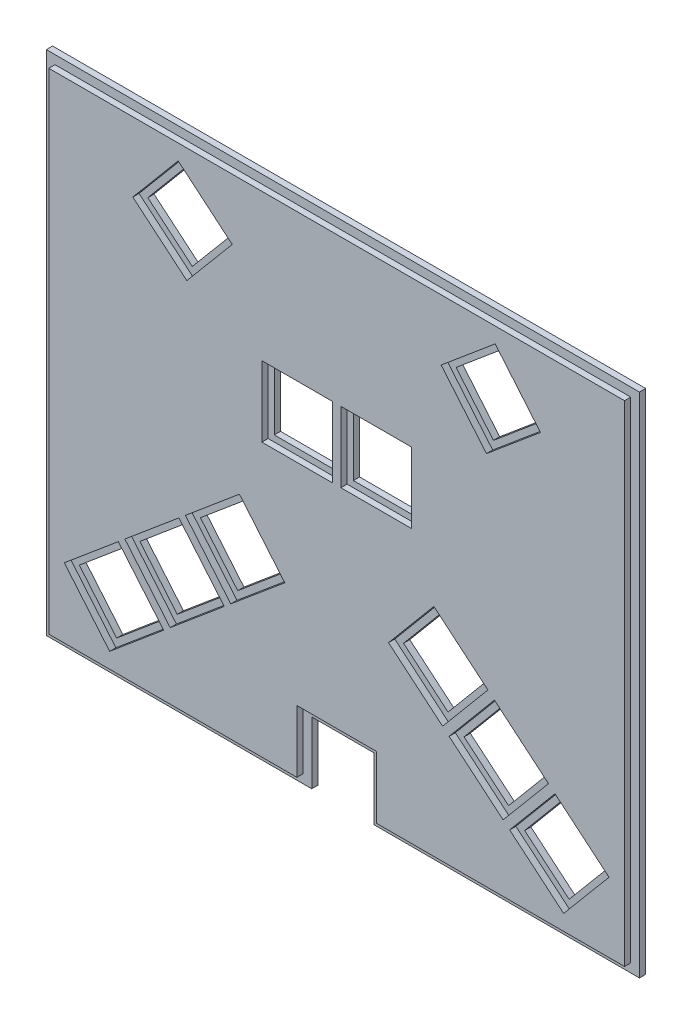
from build123d import *

# Parameters (mm, degrees)
MODEL_W                    = 142.95
MODEL_H                    = 122.297505408
MODEL_W_2                  = 14
MODEL_H_2                  = 14
SALIENTE_EXTRUIR1_DEPTH    = 0.75
CROQUIS2_W                 = 15
CROQUIS2_H                 = 30
CORTAR_EXTRUIR1_DEPTH      = 183.563364442
CROQUIS3_W                 = 17
CROQUIS3_H                 = 17
SALIENTE_EXTRUIR2_DEPTH    = 1.5
S_LIDO_MOVER_COPIAR1_ANGLE = 180


with BuildPart() as part:
    # Model → Saliente-Extruir1 (new, symmetric)
    with BuildSketch(Plane.XY):
        with Locations((67.525, 57.198752704)):
            Rectangle(MODEL_W, MODEL_H)
        with Locations((58, 42)):
            Rectangle(MODEL_W_2, MODEL_H_2, mode=Mode.SUBTRACT)
        Polygon((18.593146641, 87.427779239), (29.317768845, 78.428752704), (38.316795381, 89.153374907), (27.592173177, 98.152401443), align=None, mode=Mode.SUBTRACT)
        Polygon((103.814404332, 23.723648739), (114.539026536, 14.724622204), (105.54, 4), (94.815377796, 12.999026536), align=None, mode=Mode.SUBTRACT)
        Polygon((33.186293283, 75.182675275), (43.910915486, 66.183648739), (52.909942022, 76.908270943), (42.185319818, 85.907297479), align=None, mode=Mode.SUBTRACT)
        Polygon((20.510973464, 14.724622204), (29.51, 4), (40.234622204, 12.999026536), (31.235595668, 23.723648739), align=None, mode=Mode.SUBTRACT)
        with Locations((77.05, 42)):
            Rectangle(MODEL_W_2, MODEL_H_2, mode=Mode.SUBTRACT)
        Polygon((92.864680182, 85.907297479), (101.863706717, 75.182675275), (91.139084514, 66.183648739), (82.140057978, 76.908270943), align=None, mode=Mode.SUBTRACT)
        Polygon((107.457826823, 98.152401443), (116.456853359, 87.427779239), (105.732231155, 78.428752704), (96.733204619, 89.153374907), align=None, mode=Mode.SUBTRACT)
        Polygon((4, 99.672883204), (14.724622204, 90.673856668), (23.723648739, 101.398478872), (12.999026536, 110.397505408), align=None, mode=Mode.SUBTRACT)
        Polygon((120.325377796, 90.673856668), (111.326351261, 101.398478872), (122.050973464, 110.397505408), (131.05, 99.672883204), align=None, mode=Mode.SUBTRACT)
    extrude(amount=SALIENTE_EXTRUIR1_DEPTH, both=True)

    # Croquis2 → Cortar-Extruir1 (cut, through all)
    with BuildSketch(Plane.XY.offset(0.75)):
        with Locations((67.525, 118.347505408)):
            Rectangle(CROQUIS2_W, CROQUIS2_H)
    extrude(amount=-CORTAR_EXTRUIR1_DEPTH, mode=Mode.SUBTRACT)

    # Croquis3 → Saliente-Extruir2 (add)
    with BuildSketch(Plane(origin=(0, 0, -0.75), x_dir=(-1, 0, 0), z_dir=(0, 0, -1))):
        Polygon((-57.925, 101.247505408), (-77.125, 101.247505408), (-77.125, 116.247505408), (-136.9, 116.247505408), (-136.9, -1.85), (1.85, -1.85), (1.85, 116.247505408), (-57.925, 116.247505408), align=None)
        Polygon((-29.32511475, 1.886751921), (-18.397725385, 14.909507454), (-31.420480918, 25.836896818), (-42.347870283, 12.814141285), align=None, mode=Mode.SUBTRACT)
        with Locations((-58, 42)):
            Rectangle(CROQUIS3_W, CROQUIS3_H, mode=Mode.SUBTRACT)
        with Locations((-77.05, 42)):
            Rectangle(CROQUIS3_W, CROQUIS3_H, mode=Mode.SUBTRACT)
        Polygon((-105.72488525, 1.886751921), (-92.702129717, 12.814141285), (-103.629519082, 25.836896818), (-116.652274615, 14.909507454), align=None, mode=Mode.SUBTRACT)
        Polygon((-1.886751921, 99.487997954), (-12.814141285, 112.510753487), (-25.836896818, 101.583364122), (-14.909507454, 88.560608589), align=None, mode=Mode.SUBTRACT)
        Polygon((-16.479898562, 87.242893989), (-27.407287927, 100.265649522), (-40.43004346, 89.338260158), (-29.502654095, 76.315504625), align=None, mode=Mode.SUBTRACT)
        Polygon((-31.073045204, 74.997790025), (-42.000434568, 88.020545558), (-55.023190101, 77.093156193), (-44.095800737, 64.07040066), align=None, mode=Mode.SUBTRACT)
        Polygon((-90.954199263, 64.07040066), (-80.026809899, 77.093156193), (-93.049565432, 88.020545558), (-103.976954796, 74.997790025), align=None, mode=Mode.SUBTRACT)
        Polygon((-105.547345905, 76.315504625), (-94.61995654, 89.338260158), (-107.642712073, 100.265649522), (-118.570101438, 87.242893989), align=None, mode=Mode.SUBTRACT)
        Polygon((-120.140492546, 88.560608589), (-109.213103182, 101.583364122), (-122.235858715, 112.510753487), (-133.163248079, 99.487997954), align=None, mode=Mode.SUBTRACT)
    extrude(amount=SALIENTE_EXTRUIR2_DEPTH)


with BuildPart() as part_1:
    # Sólido-Mover/Copiar1: moved
    add(part.part.rotate(Axis((0, 57.198752704, -0.75), (1, 0, 0)), S_LIDO_MOVER_COPIAR1_ANGLE))


solid = part_1.part
